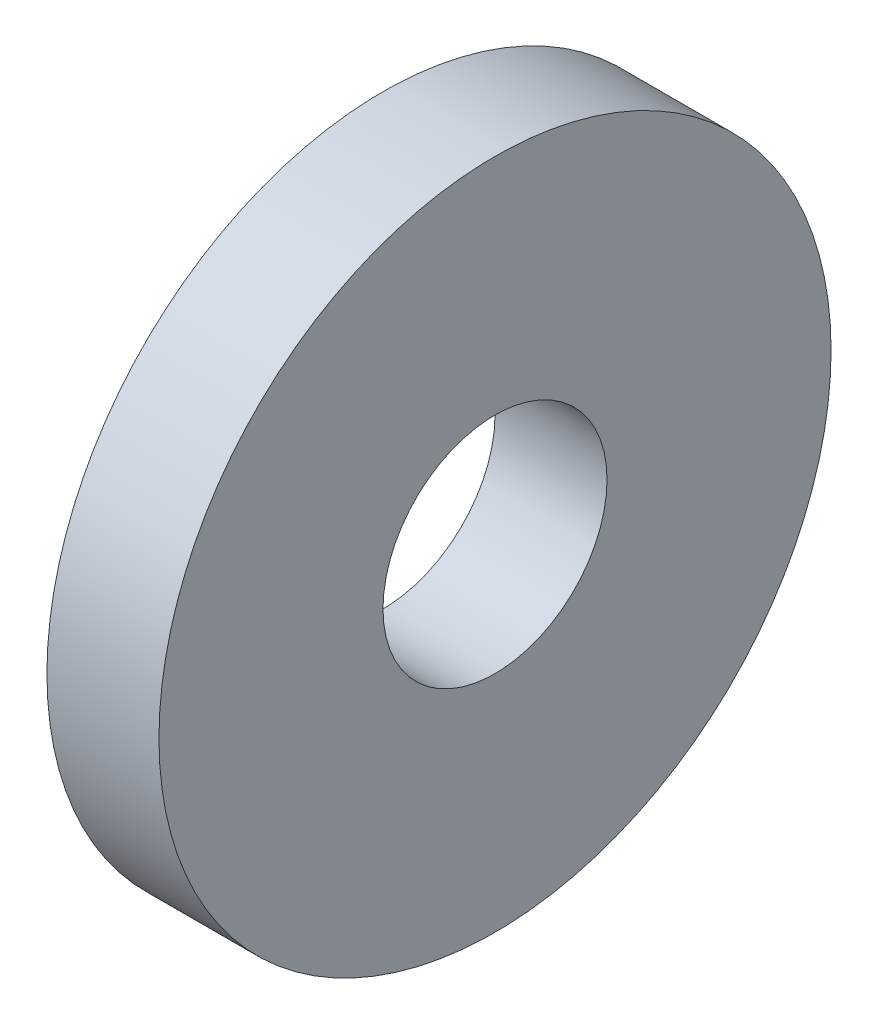
from build123d import *

# Parameters (mm, degrees)
SKETCH1_R           = 19.05
SKETCH1_R_2         = 6.35
BOSS_EXTRUDE1_DEPTH = 6.35


with BuildPart() as part:
    # Sketch1 → Boss-Extrude1 (new body)
    with BuildSketch(Plane(origin=(0, 0, 0), x_dir=(0, 0, -1), z_dir=(1, 0, 0))):
        Circle(SKETCH1_R)
        Circle(SKETCH1_R_2, mode=Mode.SUBTRACT)
    extrude(amount=BOSS_EXTRUDE1_DEPTH)


solid = part.part
